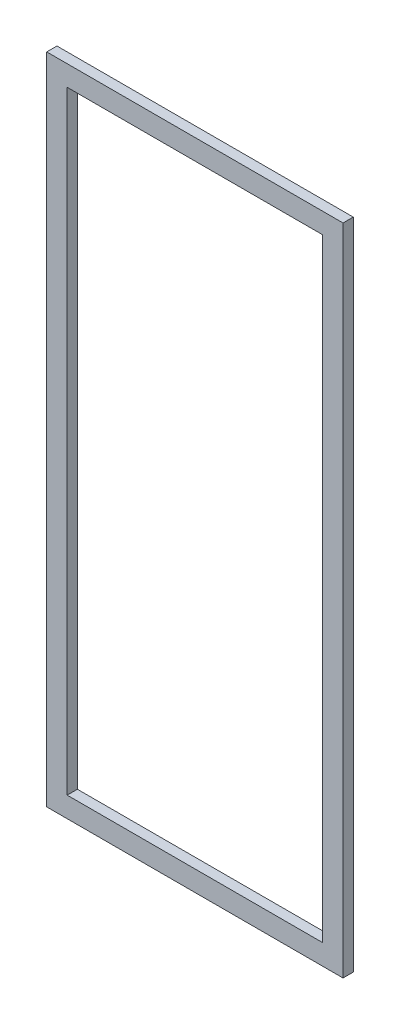
from build123d import *

# Parameters (mm, degrees)
SKETCH2_W           = 29
SKETCH2_H           = 64
BOSS_EXTRUDE1_DEPTH = 1
SKETCH3_W           = 25
SKETCH3_H           = 60
CUT_EXTRUDE4_DEPTH  = 1


with BuildPart() as part:
    # Sketch2 → Boss-Extrude1 (new body)
    with BuildSketch(Plane.XY):
        Rectangle(SKETCH2_W, SKETCH2_H)
    extrude(amount=-BOSS_EXTRUDE1_DEPTH)

    # Sketch3 → Cut-Extrude4 (cut)
    with BuildSketch(Plane.XY):
        Rectangle(SKETCH3_W, SKETCH3_H)
    extrude(amount=-CUT_EXTRUDE4_DEPTH, mode=Mode.SUBTRACT)


solid = part.part
